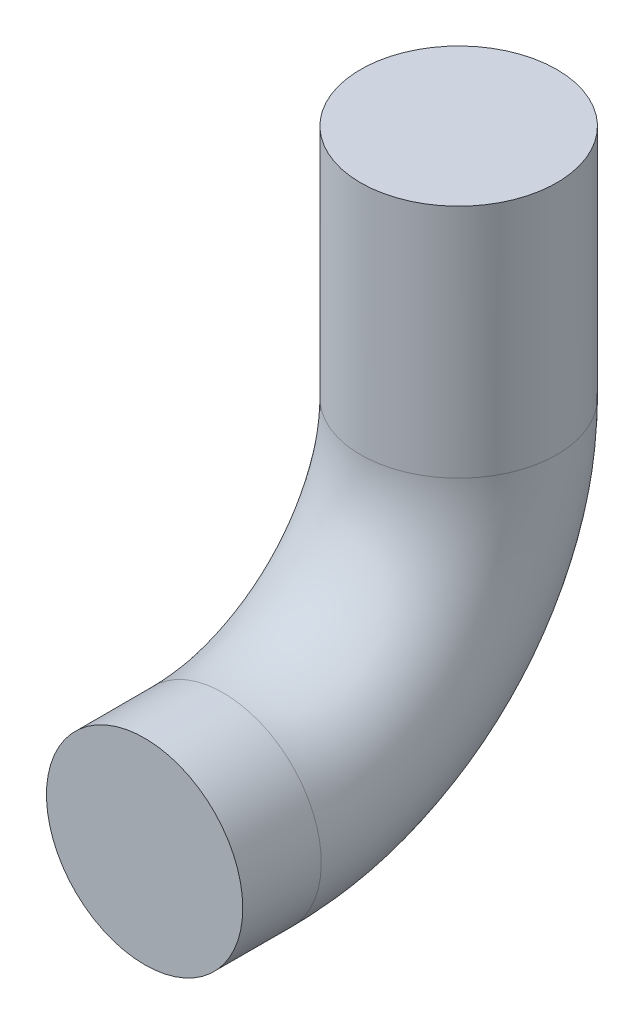
from build123d import *

# Parameters (mm, degrees)
ESQUISSE5_R        = 1.25
R_VOLUTION1_ANGLE  = 90
ESQUISSE6_R        = 1.25
BOSS_EXTRU_3_DEPTH = 1
ESQUISSE7_R        = 1.25
BOSS_EXTRU_4_DEPTH = 3


with BuildPart() as part:
    # Esquisse5 → Révolution1 (revolve)
    with BuildSketch(Plane.XY):
        with Locations((0, -3)):
            Circle(ESQUISSE5_R)
    revolve(axis=Axis((-1.070799248, 0, 0), (1, 0, 0)), revolution_arc=R_VOLUTION1_ANGLE)

    # Esquisse6 → Boss.-Extru.3 (add)
    with BuildSketch(Plane.XY):
        with Locations(Location((0, -3, 0), (0, 0, 270))):
            Circle(ESQUISSE6_R)
    extrude(amount=BOSS_EXTRU_3_DEPTH)

    # Esquisse7 → Boss.-Extru.4 (add)
    with BuildSketch(Plane(origin=(0, 0, 0), x_dir=(1, 0, 0), z_dir=(0, 1, 0))):
        with Locations(Location((0, 3, 0), (0, 0, 90))):
            Circle(ESQUISSE7_R)
    extrude(amount=BOSS_EXTRU_4_DEPTH)


solid = part.part
